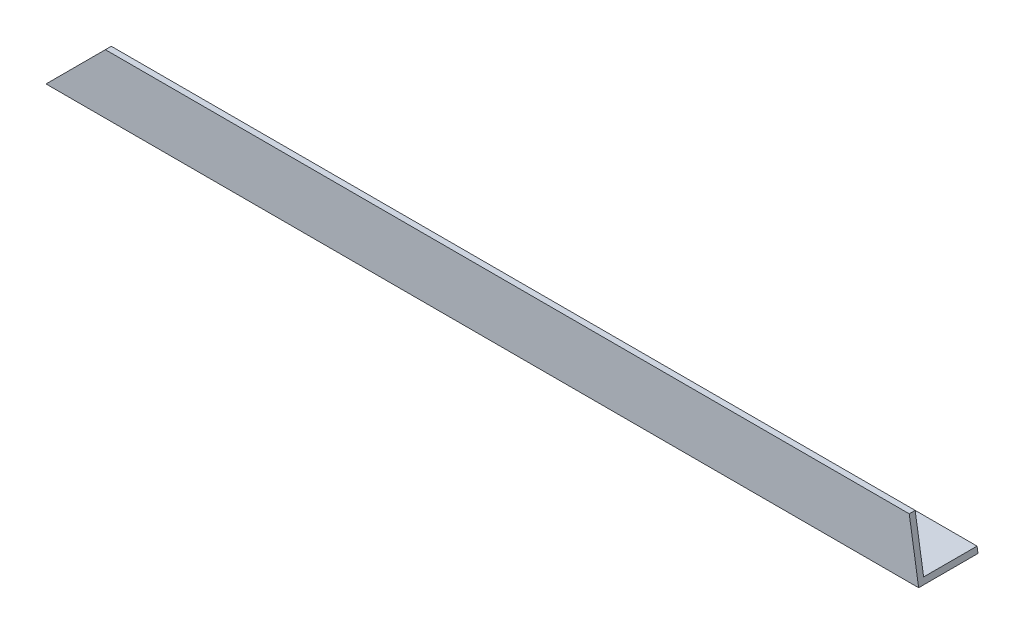
from build123d import *

# Parameters (mm, degrees)
BOSS_EXTRUDE1_DEPTH = 294
CUT_EXTRUDE1_DEPTH  = 296.357410606


with BuildPart() as part:
    # Sketch1 → Boss-Extrude1 (new body)
    with BuildSketch(Plane(origin=(0, 0, 0), x_dir=(0, 0, -1), z_dir=(1, 0, 0))):
        Polygon((0, 20), (0, 0), (20, 0), (20, 2), (2, 2), (2, 20), align=None)
    extrude(amount=BOSS_EXTRUDE1_DEPTH)

    # Sketch2 → Cut-Extrude1 (cut, through all)
    with BuildSketch(Plane(origin=(0, 0, 0), x_dir=(-1, 0, 0), z_dir=(0, 0, -1))):
        Polygon((0, 0), (-20, 20), (0, 20), align=None)
        Polygon((-294, 0), (-290.832311194, 20), (-294, 20), align=None)
    extrude(amount=CUT_EXTRUDE1_DEPTH, mode=Mode.SUBTRACT)


solid = part.part
